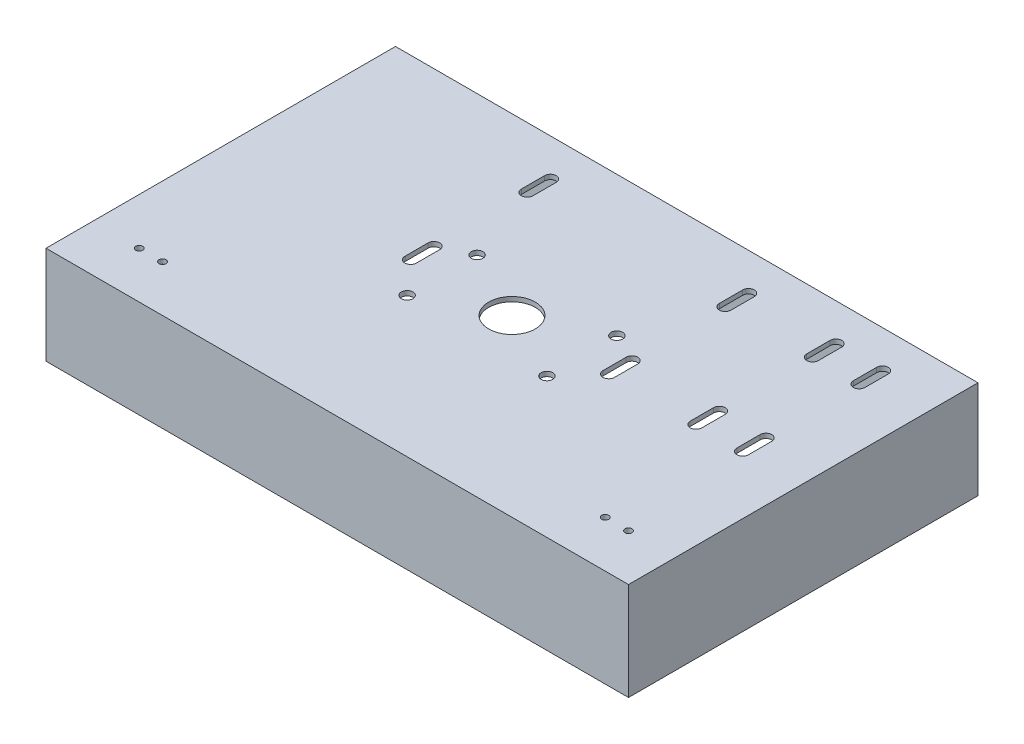
from build123d import *

# Parameters (mm, degrees)
SKETCH1_W           = 250
SKETCH1_H           = 150
BOSS_EXTRUDE1_DEPTH = 2
SKETCH2_R           = 10
CUT_EXTRUDE1_DEPTH  = 2
CUT_EXTRUDE46_DEPTH = 10
CUT_EXTRUDE59_DEPTH = 10
SKETCH9_R           = 2.5
CUT_EXTRUDE60_DEPTH = 10
SKETCH19_R          = 1.5
CUT_EXTRUDE63_DEPTH = 10
SKETCH20_W          = 250
SKETCH20_H          = 150
SKETCH20_W_2        = 240
SKETCH20_H_2        = 140
BOSS_EXTRUDE5_DEPTH = 40


with BuildPart() as part:
    # Sketch1 → Boss-Extrude1 (new body)
    with BuildSketch(Plane(origin=(0, 0, 0), x_dir=(1, 0, 0), z_dir=(0, 1, 0))):
        Rectangle(SKETCH1_W, SKETCH1_H)
    extrude(amount=BOSS_EXTRUDE1_DEPTH)

    # Sketch2 → Cut-Extrude1 (cut)
    with BuildSketch(Plane(origin=(0, 2, 0), x_dir=(1, 0, 0), z_dir=(0, 1, 0))):
        with Locations(Location((0, 0, 0), (0, 0, 270))):
            Circle(SKETCH2_R)
    extrude(amount=-CUT_EXTRUDE1_DEPTH, mode=Mode.SUBTRACT)

    # Sketch7 → Cut-Extrude46 (cut)
    with BuildSketch(Plane(origin=(0, 2, 0), x_dir=(1, 0, 0), z_dir=(0, 1, 0))):
        with BuildLine():
            Line((102.5, 59), (102.5, 49))
            ThreePointArc((102.5, 49), (100, 46.5), (97.5, 49))
            Line((97.5, 49), (97.5, 59))
            ThreePointArc((97.5, 59), (100, 61.5), (102.5, 59))
        make_face()
        with BuildLine():
            Line((77.5, 59), (77.5, 49))
            ThreePointArc((77.5, 49), (80, 46.5), (82.5, 49))
            Line((82.5, 49), (82.5, 59))
            ThreePointArc((82.5, 59), (80, 61.5), (77.5, 59))
        make_face()
        with BuildLine():
            Line((82.5, -1), (82.5, 9))
            ThreePointArc((82.5, 9), (80, 11.5), (77.5, 9))
            Line((77.5, 9), (77.5, -1))
            ThreePointArc((77.5, -1), (80, -3.5), (82.5, -1))
        make_face()
        with BuildLine():
            Line((97.5, -1), (97.5, 9))
            ThreePointArc((97.5, 9), (100, 11.5), (102.5, 9))
            Line((102.5, 9), (102.5, -1))
            ThreePointArc((102.5, -1), (100, -3.5), (97.5, -1))
        make_face()
    extrude(amount=-CUT_EXTRUDE46_DEPTH, mode=Mode.SUBTRACT)

    # Sketch3 → Cut-Extrude59 (cut)
    with BuildSketch(Plane.XZ):
        with BuildLine():
            Line((-40, -9), (-40, 1))
            ThreePointArc((-40, 1), (-42.5, 3.5), (-45, 1))
            Line((-45, 1), (-45, -9))
            ThreePointArc((-45, -9), (-42.5, -11.5), (-40, -9))
        make_face()
        with BuildLine():
            Line((-40, -49), (-40, -59))
            ThreePointArc((-40, -59), (-42.5, -61.5), (-45, -59))
            Line((-45, -59), (-45, -49))
            ThreePointArc((-45, -49), (-42.5, -46.5), (-40, -49))
        make_face()
        with BuildLine():
            Line((40, -9), (40, 1))
            ThreePointArc((40, 1), (42.5, 3.5), (45, 1))
            Line((45, 1), (45, -9))
            ThreePointArc((45, -9), (42.5, -11.5), (40, -9))
        make_face()
        with BuildLine():
            Line((40, -49), (40, -59))
            ThreePointArc((40, -59), (42.5, -61.5), (45, -59))
            Line((45, -59), (45, -49))
            ThreePointArc((45, -49), (42.5, -46.5), (40, -49))
        make_face()
    extrude(amount=-CUT_EXTRUDE59_DEPTH, mode=Mode.SUBTRACT)

    # Sketch9 → Cut-Extrude60 (cut)
    with BuildSketch(Plane(origin=(0, 2, 0), x_dir=(1, 0, 0), z_dir=(0, 1, 0))):
        with Locations(Location((-30, 15, 0), (0, 0, 270))):
            Circle(SKETCH9_R)
        with Locations(Location((-30, -15, 0), (0, 0, 270))):
            Circle(SKETCH9_R)
        with Locations(Location((30, -15, 0), (0, 0, 90))):
            Circle(SKETCH9_R)
        with Locations(Location((30, 15, 0), (0, 0, 90))):
            Circle(SKETCH9_R)
    extrude(amount=-CUT_EXTRUDE60_DEPTH, mode=Mode.SUBTRACT)

    # Sketch19 → Cut-Extrude63 (cut)
    with BuildSketch(Plane(origin=(0, 2, 0), x_dir=(1, 0, 0), z_dir=(0, 1, 0))):
        with Locations(Location((105, -55, 0), (0, 0, 270))):
            Circle(SKETCH19_R)
        with Locations(Location((95, -55, 0), (0, 0, 270))):
            Circle(SKETCH19_R)
        with Locations(Location((-95, -55, 0), (0, 0, 90))):
            Circle(SKETCH19_R)
        with Locations(Location((-105, -55, 0), (0, 0, 90))):
            Circle(SKETCH19_R)
    extrude(amount=-CUT_EXTRUDE63_DEPTH, mode=Mode.SUBTRACT)

    # Sketch20 → Boss-Extrude5 (add)
    with BuildSketch(Plane.XZ):
        Rectangle(SKETCH20_W, SKETCH20_H)
        Rectangle(SKETCH20_W_2, SKETCH20_H_2, mode=Mode.SUBTRACT)
    extrude(amount=BOSS_EXTRUDE5_DEPTH)


solid = part.part
